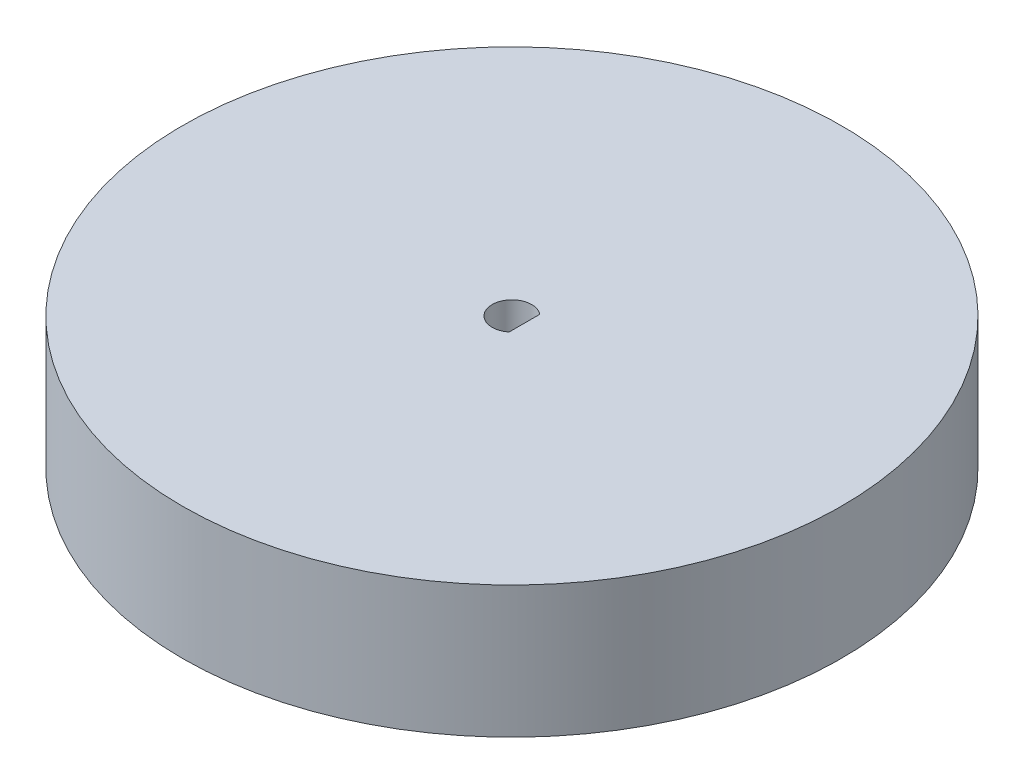
from build123d import *

# Parameters (mm, degrees)
SKETCH2_R           = 25
BOSS_EXTRUDE1_DEPTH = 10


with BuildPart() as part:
    # Sketch2 → Boss-Extrude1 (new body)
    with BuildSketch(Plane(origin=(0, 0, 0), x_dir=(1, 0, 0), z_dir=(0, 1, 0))):
        with Locations(Location((0, 0, 0), (0, 0, 270))):
            Circle(SKETCH2_R)
        with BuildLine():
            Line((0.95, 1.160818677), (0.95, -1.160818677))
            ThreePointArc((0.95, -1.160818677), (-1.5, 0), (0.95, 1.160818677))
        make_face(mode=Mode.SUBTRACT)
    extrude(amount=BOSS_EXTRUDE1_DEPTH)


solid = part.part
